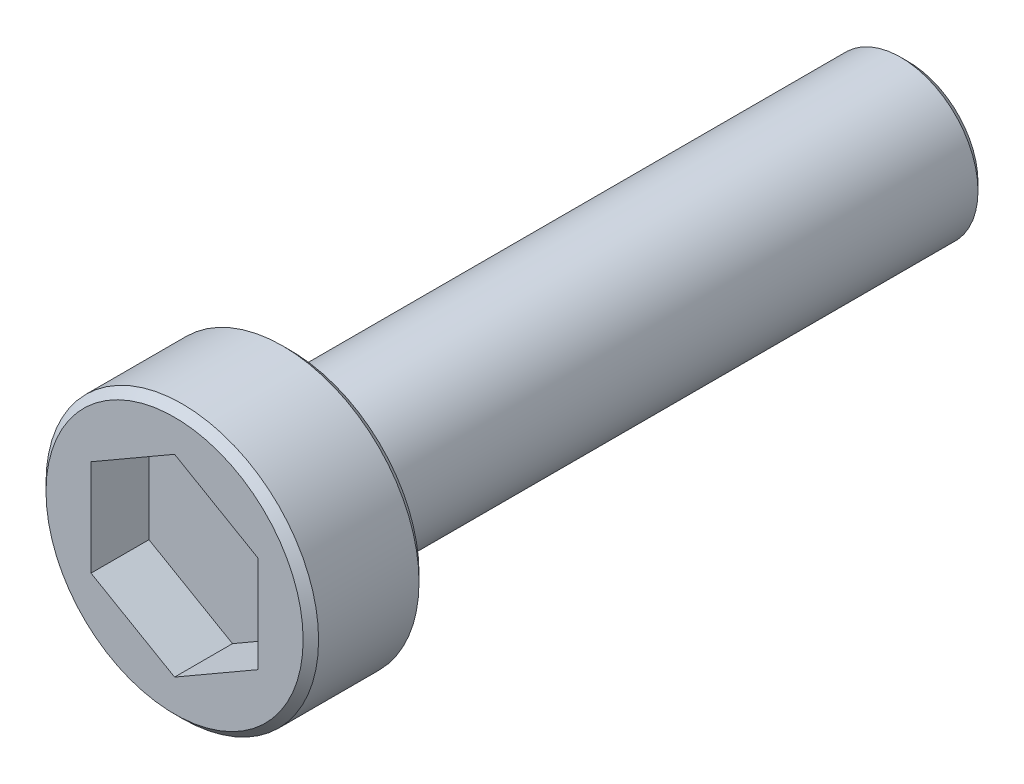
from build123d import *

# Parameters (mm, degrees)
SKETCH_1_R          = 2
EXTRUDE_1_DEPTH     = 16
SKETCH_2_R          = 3.52854217
EXTRUDE_3_DEPTH     = 3
CUT_EXTRUDE_2_DEPTH = 1.5
CHAMFER_1_SIZE      = 0.2
CHAMFER_2_SIZE      = 0.2


with BuildPart() as part:
    # 草图1 → 凸台-拉伸1 (new body)
    with BuildSketch(Plane.XY):
        Circle(SKETCH_1_R)
    extrude(amount=EXTRUDE_1_DEPTH)

    # 草图2 → 凸台-拉伸3 (add)
    with BuildSketch(Plane.XY.offset(16)):
        Circle(SKETCH_2_R)
    extrude(amount=EXTRUDE_3_DEPTH)

    # 草图3 → 切除-拉伸2 (cut)
    with BuildSketch(Plane.XY.offset(19)):
        Polygon((0, 2.497687594), (-2.163060907, 1.248843797), (-2.163060907, -1.248843797), (0, -2.497687594), (2.163060907, -1.248843797), (2.163060907, 1.248843797), align=None)
    extrude(amount=-CUT_EXTRUDE_2_DEPTH, mode=Mode.SUBTRACT)

    # 倒角1
    chamfer_1_edges = [part.edges().sort_by_distance(p)[0] for p in [
        (-2, 0, 0),
    ]]
    chamfer(chamfer_1_edges, length=CHAMFER_1_SIZE)

    # 倒角2
    chamfer_2_edges = [part.edges().sort_by_distance(p)[0] for p in [
        (-3.52854217, 0, 16),
        (-3.52854217, 0, 19),
    ]]
    chamfer(chamfer_2_edges, length=CHAMFER_2_SIZE)


solid = part.part
